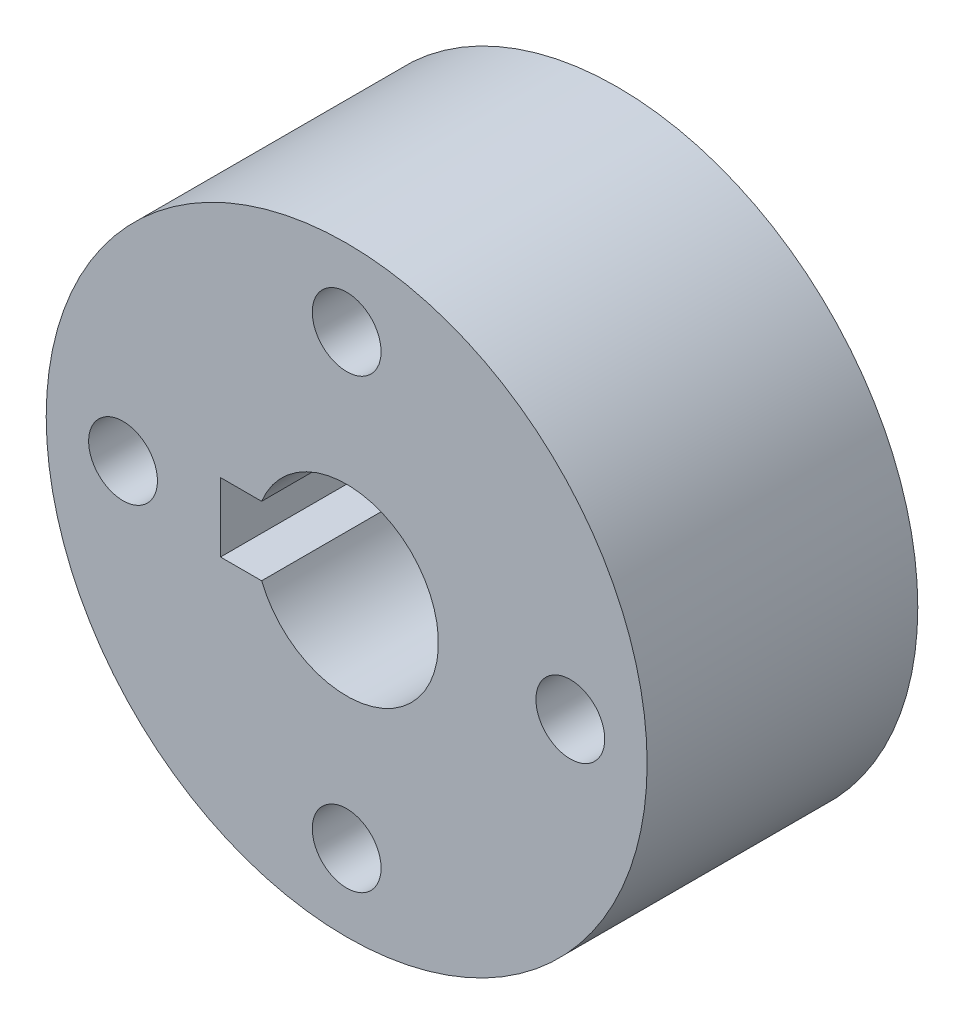
from build123d import *

# Parameters (mm, degrees)
SKETCH_1_R          = 13.1
EXTRUDE_1_DEPTH     = 11.8
SKETCH_3_R          = 1.5
CUT_EXTRUDE_1_DEPTH = 5
SKETCH_4_R          = 1.5
CUT_EXTRUDE_2_DEPTH = 15


with BuildPart() as part:
    # 草图1 → 凸台-拉伸1 (new body)
    with BuildSketch(Plane.XY):
        Circle(SKETCH_1_R)
    extrude(amount=EXTRUDE_1_DEPTH)

    # 草图3 → 切除-拉伸1 (cut)
    with BuildSketch(Plane.XY.offset(11.8)):
        with Locations((-9.75, 0)):
            Circle(SKETCH_3_R)
        with Locations((0, 9.75)):
            Circle(SKETCH_3_R)
        with Locations((9.75, 0)):
            Circle(SKETCH_3_R)
        with Locations((0, -9.75)):
            Circle(SKETCH_3_R)
    extrude(amount=-CUT_EXTRUDE_1_DEPTH, mode=Mode.SUBTRACT)

    # 草图4 → 切除-拉伸2 (cut)
    with BuildSketch(Plane.XY.offset(11.8)):
        with Locations((-9.75, 0)):
            Circle(SKETCH_4_R)
        with Locations((9.75, 0)):
            Circle(SKETCH_4_R)
        with BuildLine():
            Line((-5.5, -1.5), (-5.5, 1.5))
            Line((-5.5, 1.5), (-3.708099244, 1.5))
            ThreePointArc((-3.708099244, 1.5), (4, 0), (-3.708099244, -1.5))
            Line((-3.708099244, -1.5), (-5.5, -1.5))
        make_face()
    extrude(amount=-CUT_EXTRUDE_2_DEPTH, mode=Mode.SUBTRACT)


solid = part.part
